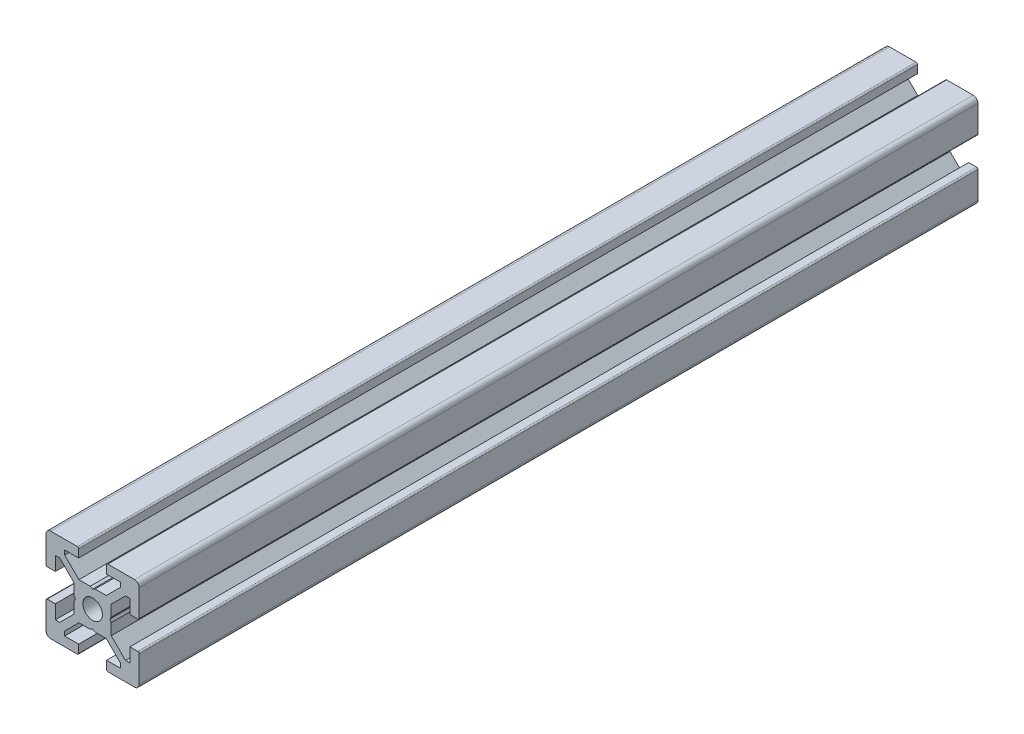
from build123d import *

# Parameters (mm, degrees)
BOSS_EXTRUDE1_DEPTH = 180
SKETCH2_W           = 400
SKETCH2_H           = 2.1


with BuildPart() as part:
    # Sketch1 → Boss-Extrude1 (new body)
    with BuildSketch(Plane.XY):
        with BuildLine():
            Line((-10, 9), (-10, 3.29999995))
            ThreePointArc((-10, 3.29999995), (-9.912132049, 3.087867916), (-9.7, 3))
            Line((-9.7, 3), (-8, 3))
            Line((-8, 3), (-8, 6))
            Line((-8, 6), (-7.060677, 6))
            Line((-7.060677, 6), (-4, 2.93932965))
            Line((-4, 2.93932965), (-4, 0.519615242))
            Line((-4, 0.519615242), (-3.699996283, -6.437e-06))
            Line((-3.699996283, -6.437e-06), (-4, -0.519628117))
            Line((-4, -0.519628117), (-4, -2.93933725))
            Line((-4, -2.93933725), (-7.0606695, -6))
            Line((-7.0606695, -6), (-8, -6))
            Line((-8, -6), (-8, -3))
            Line((-8, -3), (-9.7, -3))
            ThreePointArc((-9.7, -3), (-9.912132049, -3.087867916), (-10, -3.29999995))
            Line((-10, -3.29999995), (-10, -9))
            ThreePointArc((-10, -9), (-9.707106781, -9.707106781), (-9, -10))
            Line((-9, -10), (-3.29999995, -10))
            ThreePointArc((-3.29999995, -10), (-3.087867916, -9.912132049), (-3, -9.7))
            Line((-3, -9.7), (-3, -8))
            Line((-3, -8), (-6, -8))
            Line((-6, -8), (-6, -7.0606515))
            Line((-6, -7.0606515), (-2.9393489, -4))
            Line((-2.9393489, -4), (-0.519615242, -4))
            Line((-0.519615242, -4), (6.437e-06, -3.699996283))
            Line((6.437e-06, -3.699996283), (0.519628117, -4))
            Line((0.519628117, -4), (2.9393227, -4))
            Line((2.9393227, -4), (6, -7.060677))
            Line((6, -7.060677), (6, -8))
            Line((6, -8), (3, -8))
            Line((3, -8), (3, -9.7))
            ThreePointArc((3, -9.7), (3.087867916, -9.912132049), (3.29999995, -10))
            Line((3.29999995, -10), (9, -10))
            ThreePointArc((9, -10), (9.707106781, -9.707106781), (10, -9))
            Line((10, -9), (10, -3.29999995))
            ThreePointArc((10, -3.29999995), (9.912132049, -3.087867916), (9.7, -3))
            Line((9.7, -3), (8, -3))
            Line((8, -3), (8, -6))
            Line((8, -6), (7.0606435, -6))
            Line((7.0606435, -6), (4, -2.9393482))
            Line((4, -2.9393482), (4, -0.519615242))
            Line((4, -0.519615242), (3.699996283, 6.437e-06))
            Line((3.699996283, 6.437e-06), (4, 0.519628117))
            Line((4, 0.519628117), (4, 2.9393401))
            Line((4, 2.9393401), (7.060651, 6))
            Line((7.060651, 6), (8, 6))
            Line((8, 6), (8, 3))
            Line((8, 3), (9.7, 3))
            ThreePointArc((9.7, 3), (9.912132049, 3.087867916), (10, 3.29999995))
            Line((10, 3.29999995), (10, 9))
            ThreePointArc((10, 9), (9.707106781, 9.707106781), (9, 10))
            Line((9, 10), (3.29999995, 10))
            ThreePointArc((3.29999995, 10), (3.087867916, 9.912132049), (3, 9.7))
            Line((3, 9.7), (3, 8))
            Line((3, 8), (6, 8))
            Line((6, 8), (6, 7.060669))
            Line((6, 7.060669), (2.9393308, 4))
            Line((2.9393308, 4), (0.519615242, 4))
            Line((0.519615242, 4), (-6.437e-06, 3.699996283))
            Line((-6.437e-06, 3.699996283), (-0.519628117, 4))
            Line((-0.519628117, 4), (-2.93935655, 4))
            Line((-2.93935655, 4), (-6, 7.0606435))
            Line((-6, 7.0606435), (-6, 8))
            Line((-6, 8), (-3, 8))
            Line((-3, 8), (-3, 9.7))
            ThreePointArc((-3, 9.7), (-3.087867966, 9.912132034), (-3.3, 10))
            Line((-3.3, 10), (-9, 10))
            ThreePointArc((-9, 10), (-9.707106781, 9.707106781), (-10, 9))
        make_face()
    extrude(amount=-BOSS_EXTRUDE1_DEPTH)

    # Sketch2 → Cut-Revolve1 (revolve, cut)
    with BuildSketch(Plane(origin=(0, 0, 0), x_dir=(0, 0, -1), z_dir=(1, 0, 0)), mode=Mode.PRIVATE) as cut_revolve1_sk:
        with Locations((200, 1.05)):
            Rectangle(SKETCH2_W, SKETCH2_H)
    revolve(cut_revolve1_sk.sketch.rotate(Axis((0, 0, -400), (0, 0, 1)), 270), axis=Axis((0, 0, -400), (0, 0, 1)), mode=Mode.SUBTRACT)


solid = part.part
